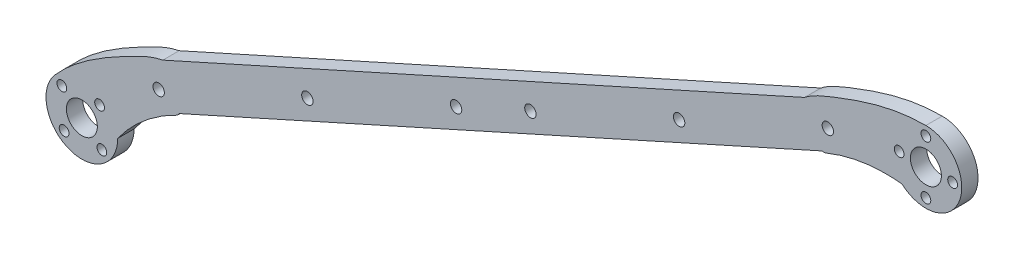
from build123d import *

# Parameters (mm, degrees)
SKETCH1_R           = 1.5
SKETCH1_R_2         = 4.75
SKETCH1_R_3         = 1.75
BOSS_EXTRUDE1_DEPTH = 5


with BuildPart() as part:
    # Sketch1 → Boss-Extrude1 (new body)
    with BuildSketch(Plane.XY):
        with BuildLine():
            Line((-228.983312247, -100.327673659), (-31.823690309, -11.677627043))
            ThreePointArc((-31.823690309, -11.677627043), (-31.180096404, -11.740933542), (-30.549947196, -11.595562287))
            add(Edge.make_bspline(
                [(-7.332121112, -8.2), (-15.261701169, -7.378248506), (-23.028748322, -8.511718389), (-30.549947196, -11.595562287)],
                knots=[0, 0, 0, 0, 0.928485629, 0.928485629, 0.928485629, 0.928485629], degree=3))
            ThreePointArc((-7.332121112, -8.2), (10.276186063, -3.924283374), (0, 11))
            add(Edge.make_bspline(
                [(-37.223327458, -0.160922187), (-34.733241197, 1.803007777), (-22.33190483, 6.92754021), (-10.110124034, 10.988248808), (0, 11)],
                knots=[0.039876476, 0.039876476, 0.039876476, 0.039876476, 0.276467277, 1, 1, 1, 1], degree=3))
            Line((-37.223327458, -0.160922187), (-234.014760878, -88.645418023))
            add(Edge.make_bspline(
                [(-234.014760878, -88.645418023), (-237.136414749, -89.204727957), (-249.199971308, -95.080489992), (-260.348583277, -101.527949282), (-267.06700619, -109.08291716)],
                knots=[0.039876476, 0.039876476, 0.039876476, 0.039876476, 0.276467277, 1, 1, 1, 1], degree=3))
            ThreePointArc((-267.06700619, -109.08291716), (-262.722901285, -126.674477262), (-247.838660732, -116.340377524))
            add(Edge.make_bspline(
                [(-247.838660732, -116.340377524), (-243.190858822, -109.863383406), (-237.188340902, -104.805562326), (-229.890025639, -101.226020455)],
                knots=[0, 0, 0, 0, 0.928485629, 0.928485629, 0.928485629, 0.928485629], degree=3))
            ThreePointArc((-229.890025639, -101.226020455), (-229.363080717, -100.851120634), (-228.983312247, -100.327673659))
        make_face()
        with Locations((-8.2, 0)):
            Circle(SKETCH1_R, mode=Mode.SUBTRACT)
        with Locations((0, 8.2)):
            Circle(SKETCH1_R, mode=Mode.SUBTRACT)
        with Locations((0, -8.2)):
            Circle(SKETCH1_R, mode=Mode.SUBTRACT)
        with Locations((8.2, 0)):
            Circle(SKETCH1_R, mode=Mode.SUBTRACT)
        Circle(SKETCH1_R_2, mode=Mode.SUBTRACT)
        with Locations(Location((-258.838577689, -116.383120199, 0), (0, 0, 180))):
            Circle(SKETCH1_R_2, mode=Mode.SUBTRACT)
        with Locations(Location((-264.280547227, -122.517039627, 0), (0, 0, 180))):
            Circle(SKETCH1_R, mode=Mode.SUBTRACT)
        with Locations(Location((-252.704658261, -121.825089736, 0), (0, 0, 180))):
            Circle(SKETCH1_R, mode=Mode.SUBTRACT)
        with Locations(Location((-264.972497117, -110.941150661, 0), (0, 0, 180))):
            Circle(SKETCH1_R, mode=Mode.SUBTRACT)
        with Locations(Location((-253.396608151, -110.249200771, 0), (0, 0, 180))):
            Circle(SKETCH1_R, mode=Mode.SUBTRACT)
        with Locations((-75.674055251, -25.316000748)):
            Circle(SKETCH1_R_3, mode=Mode.SUBTRACT)
        with Locations((-30.071768827, -4.811575057)):
            Circle(SKETCH1_R_3, mode=Mode.SUBTRACT)
        with Locations((-121.276341675, -45.820426439)):
            Circle(SKETCH1_R_3, mode=Mode.SUBTRACT)
        with Locations(Location((-235.282057735, -97.081490667, 0), (0, 0, 180))):
            Circle(SKETCH1_R_3, mode=Mode.SUBTRACT)
        with Locations(Location((-189.679771311, -76.577064976, 0), (0, 0, 180))):
            Circle(SKETCH1_R_3, mode=Mode.SUBTRACT)
        with Locations(Location((-144.077484887, -56.072639285, 0), (0, 0, 180))):
            Circle(SKETCH1_R_3, mode=Mode.SUBTRACT)
    extrude(amount=BOSS_EXTRUDE1_DEPTH)


solid = part.part
